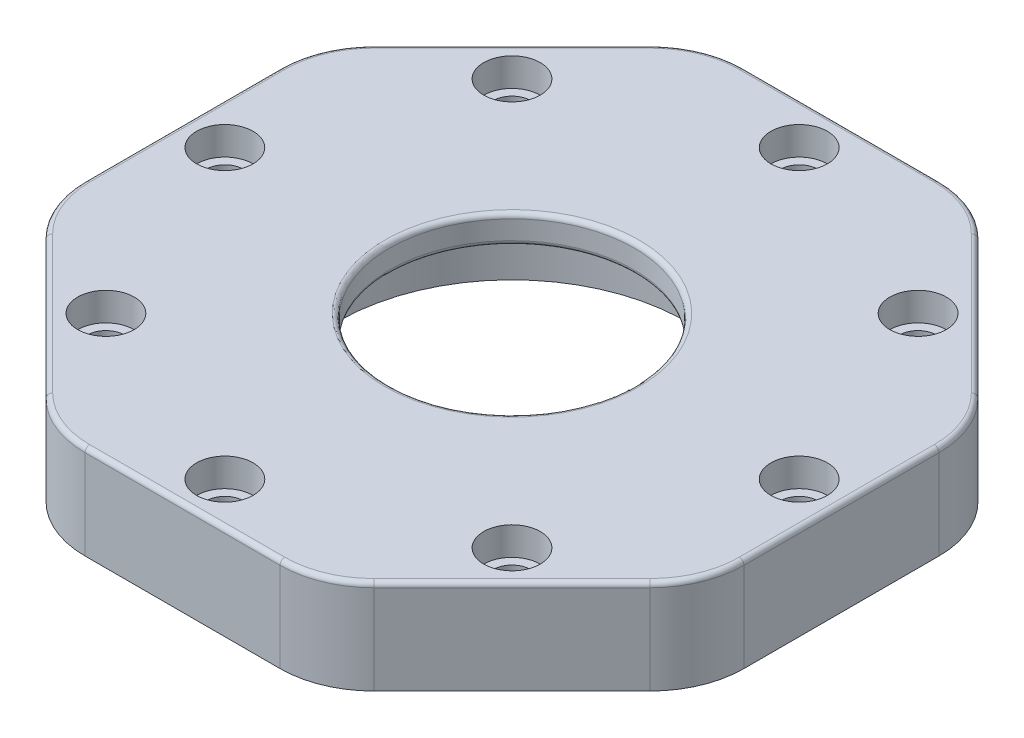
from build123d import *

# Parameters (mm, degrees)
SKETCH1_R           = 32
BOSS_EXTRUDE1_DEPTH = 10
CUT_EXTRUDE1_START  = -10
SKETCH2_R           = 18.5
CUT_EXTRUDE1_DEPTH  = 7
SKETCH3_R           = 13
CUT_EXTRUDE2_DEPTH  = 46.793012567
FILLET2_R           = 0.5
SKETCH6_R           = 32
BOSS_EXTRUDE2_DEPTH = 10
SKETCH7_R           = 2
CUT_EXTRUDE5_DEPTH  = 51.497524692
FILLET3_R           = 0.5
SKETCH8_R           = 3
CUT_EXTRUDE6_DEPTH  = 3
SKETCH5_R           = 2
CUT_EXTRUDE7_DEPTH  = 51.49752483
SKETCH9_R           = 3
CUT_EXTRUDE8_DEPTH  = 3


with BuildPart() as part:
    # Sketch1 → Boss-Extrude1 (new body)
    with BuildSketch(Plane(origin=(0, 0, 0), x_dir=(1, 0, 0), z_dir=(0, 1, 0))):
        with Locations(Location((0, 0, 0), (0, 0, 270))):
            Circle(SKETCH1_R)
    extrude(amount=BOSS_EXTRUDE1_DEPTH)

    # Sketch2 → Cut-Extrude1 (cut)
    with BuildSketch(Plane(origin=(0, 10, 0), x_dir=(1, 0, 0), z_dir=(0, 1, 0)).offset(CUT_EXTRUDE1_START)):
        with Locations(Location((0, 0, 0), (0, 0, 270))):
            Circle(SKETCH2_R)
    extrude(amount=CUT_EXTRUDE1_DEPTH, mode=Mode.SUBTRACT)

    # Sketch3 → Cut-Extrude2 (cut, through all)
    with BuildSketch(Plane(origin=(0, 7, 0), x_dir=(-1, 0, 0), z_dir=(0, -1, 0))):
        with Locations(Location((0, 0, 0), (0, 0, 90))):
            Circle(SKETCH3_R)
    extrude(amount=-CUT_EXTRUDE2_DEPTH, mode=Mode.SUBTRACT)

    # Fillet2
    fillet2_edges = [part.edges().sort_by_distance(p)[0] for p in [
        (0, 10, 13),
        (0, 7, 13),
    ]]
    fillet(fillet2_edges, radius=FILLET2_R)

    # Sketch6 → Boss-Extrude2 (add)
    with BuildSketch(Plane(origin=(0, 0, 0), x_dir=(1, 0, 0), z_dir=(0, 1, 0))):
        with BuildLine():
            Line((10.355339059, 35), (-10.355339059, 35))
            ThreePointArc((-10.355339059, 35), (-14.182173383, 34.238795325), (-17.426406871, 32.071067812))
            Line((-17.426406871, 32.071067812), (-32.071067812, 17.426406871))
            ThreePointArc((-32.071067812, 17.426406871), (-34.238795325, 14.182173383), (-35, 10.355339059))
            Line((-35, 10.355339059), (-35, -10.355339059))
            ThreePointArc((-35, -10.355339059), (-34.238795325, -14.182173383), (-32.071067812, -17.426406871))
            Line((-32.071067812, -17.426406871), (-17.426406871, -32.071067812))
            ThreePointArc((-17.426406871, -32.071067812), (-14.182173383, -34.238795325), (-10.355339059, -35))
            Line((-10.355339059, -35), (10.355339059, -35))
            ThreePointArc((10.355339059, -35), (14.182173383, -34.238795325), (17.426406871, -32.071067812))
            Line((17.426406871, -32.071067812), (32.071067812, -17.426406871))
            ThreePointArc((32.071067812, -17.426406871), (34.238795325, -14.182173383), (35, -10.355339059))
            Line((35, -10.355339059), (35, 10.355339059))
            ThreePointArc((35, 10.355339059), (34.238795325, 14.182173383), (32.071067812, 17.426406871))
            Line((32.071067812, 17.426406871), (17.426406871, 32.071067812))
            ThreePointArc((17.426406871, 32.071067812), (14.182173383, 34.238795325), (10.355339059, 35))
        make_face()
        Circle(SKETCH6_R, mode=Mode.SUBTRACT)
    extrude(amount=BOSS_EXTRUDE2_DEPTH)

    # Sketch7 → Cut-Extrude5 (cut, through all)
    with BuildSketch(Plane(origin=(0, 10, 0), x_dir=(1, 0, 0), z_dir=(0, 1, 0))):
        with Locations(Location((-21.566756826, 21.566756826, 0), (0, 0, 270))):
            Circle(SKETCH7_R)
        with Locations(Location((21.566756826, 21.566756826, 0), (0, 0, 270))):
            Circle(SKETCH7_R)
        with Locations(Location((21.566756826, -21.566756826, 0), (0, 0, 270))):
            Circle(SKETCH7_R)
        with Locations(Location((-21.566756826, -21.566756826, 0), (0, 0, 270))):
            Circle(SKETCH7_R)
    extrude(amount=-CUT_EXTRUDE5_DEPTH, mode=Mode.SUBTRACT)

    # Fillet3
    fillet3_edges = [part.edges().sort_by_distance(p)[0] for p in [
        (-34.238795325, 10, -14.182173383),
        (-35, 10, 0),
        (-34.238795325, 10, 14.182173383),
        (-24.748737342, 10, 24.748737342),
        (-14.182173383, 10, 34.238795325),
        (0, 10, 35),
        (14.182173383, 10, 34.238795325),
        (24.748737342, 10, 24.748737342),
        (34.238795325, 10, 14.182173383),
        (35, 10, 0),
        (34.238795325, 10, -14.182173383),
        (24.748737342, 10, -24.748737342),
        (14.182173383, 10, -34.238795325),
        (0, 10, -35),
        (-14.182173383, 10, -34.238795325),
        (-24.748737342, 10, -24.748737342),
    ]]
    fillet(fillet3_edges, radius=FILLET3_R)

    # Sketch8 → Cut-Extrude6 (cut)
    with BuildSketch(Plane(origin=(0, 10, 0), x_dir=(1, 0, 0), z_dir=(0, 1, 0))):
        with Locations(Location((-21.566756826, 21.566756826, 0), (0, 0, 270))):
            Circle(SKETCH8_R)
        with Locations(Location((21.566756826, 21.566756826, 0), (0, 0, 270))):
            Circle(SKETCH8_R)
        with Locations(Location((21.566756826, -21.566756826, 0), (0, 0, 270))):
            Circle(SKETCH8_R)
        with Locations(Location((-21.566756826, -21.566756826, 0), (0, 0, 270))):
            Circle(SKETCH8_R)
    extrude(amount=-CUT_EXTRUDE6_DEPTH, mode=Mode.SUBTRACT)

    # Sketch5 → Cut-Extrude7 (cut, through all)
    with BuildSketch(Plane(origin=(0, 10, 0), x_dir=(1, 0, 0), z_dir=(0, 1, 0))):
        with Locations(Location((0, 30.5, 0), (0, 0, 270))):
            Circle(SKETCH5_R)
        with Locations(Location((30.5, 0, 0), (0, 0, 270))):
            Circle(SKETCH5_R)
        with Locations(Location((0, -30.5, 0), (0, 0, 270))):
            Circle(SKETCH5_R)
        with Locations(Location((-30.5, 0, 0), (0, 0, 270))):
            Circle(SKETCH5_R)
    extrude(amount=-CUT_EXTRUDE7_DEPTH, mode=Mode.SUBTRACT)

    # Sketch9 → Cut-Extrude8 (cut)
    with BuildSketch(Plane(origin=(0, 10, 0), x_dir=(1, 0, 0), z_dir=(0, 1, 0))):
        with Locations(Location((-30.5, 0, 0), (0, 0, 270))):
            Circle(SKETCH9_R)
        with Locations(Location((0, 30.5, 0), (0, 0, 270))):
            Circle(SKETCH9_R)
        with Locations(Location((30.5, 0, 0), (0, 0, 270))):
            Circle(SKETCH9_R)
        with Locations(Location((0, -30.5, 0), (0, 0, 270))):
            Circle(SKETCH9_R)
    extrude(amount=-CUT_EXTRUDE8_DEPTH, mode=Mode.SUBTRACT)


solid = part.part
